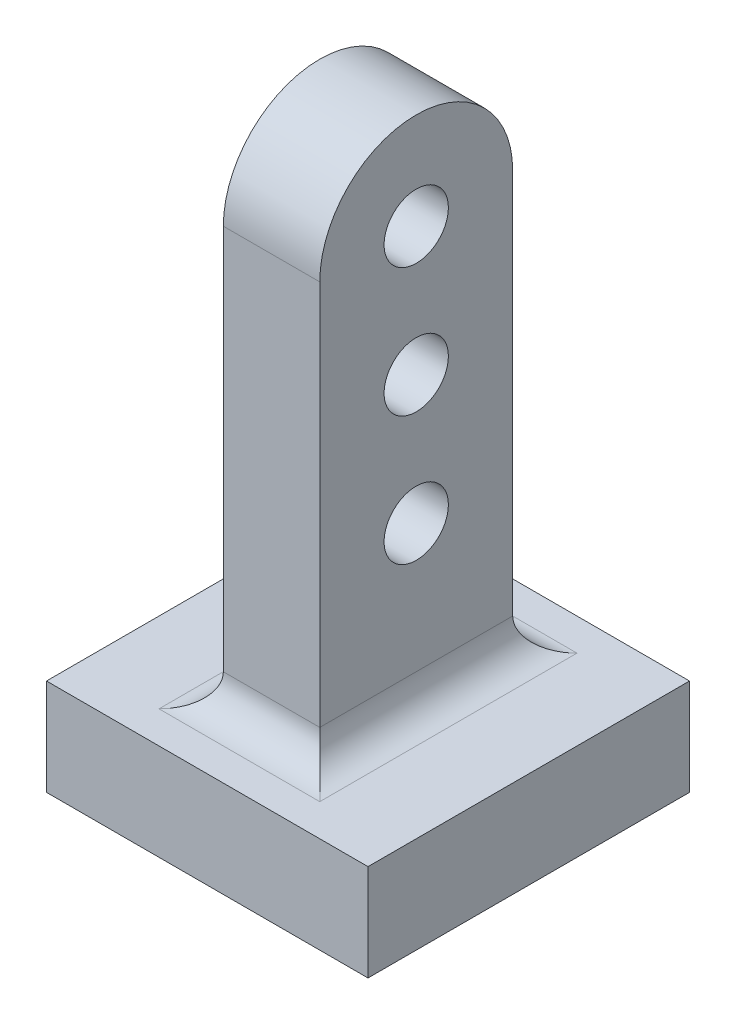
from build123d import *

# Parameters (mm, degrees)
SKETCH1_W           = 10
SKETCH1_H           = 10
BOSS_EXTRUDE1_DEPTH = 3
SKETCH2_R           = 1
BOSS_EXTRUDE2_DEPTH = 1.5
FILLET1_R           = 1


with BuildPart() as part:
    # Sketch1 → Boss-Extrude1 (new body)
    with BuildSketch(Plane(origin=(0, 0, 0), x_dir=(1, 0, 0), z_dir=(0, 1, 0))):
        Rectangle(SKETCH1_W, SKETCH1_H)
    extrude(amount=BOSS_EXTRUDE1_DEPTH)

    # Sketch2 → Boss-Extrude2 (add, symmetric)
    with BuildSketch(Plane(origin=(0, 0, 0), x_dir=(0, 0, -1), z_dir=(1, 0, 0))):
        with BuildLine():
            Line((-3, 3), (-3, 16))
            ThreePointArc((-3, 16), (0, 19), (3, 16))
            Line((3, 16), (3, 3))
            Line((3, 3), (-3, 3))
        make_face()
        with Locations((0, 16)):
            Circle(SKETCH2_R, mode=Mode.SUBTRACT)
        with Locations((0, 12)):
            Circle(SKETCH2_R, mode=Mode.SUBTRACT)
        with Locations((0, 8)):
            Circle(SKETCH2_R, mode=Mode.SUBTRACT)
    extrude(amount=BOSS_EXTRUDE2_DEPTH, both=True)

    # Fillet1
    fillet1_edges = [part.edges().sort_by_distance(p)[0] for p in [
        (1.5, 3, 0),
        (-1.5, 3, 0),
        (0, 3, 3),
        (0, 3, -3),
    ]]
    fillet(fillet1_edges, radius=FILLET1_R)


solid = part.part
